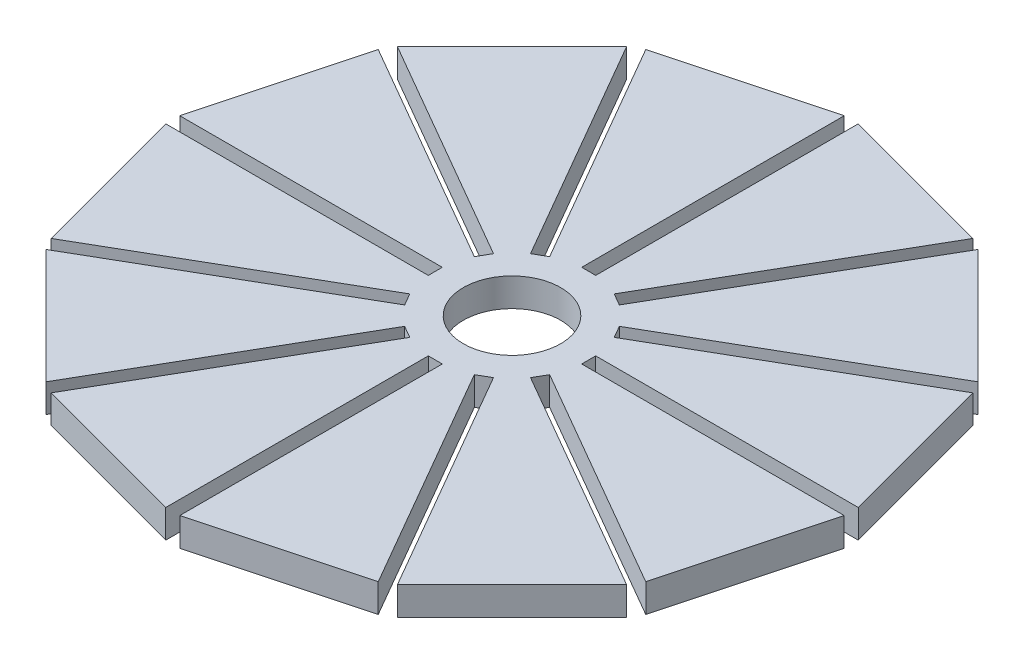
from build123d import *

# Parameters (mm, degrees)
SKETCH1_R           = 10.308435719
BOSS_EXTRUDE1_DEPTH = 6


with BuildPart() as part:
    # Sketch1 → Boss-Extrude1 (new body)
    with BuildSketch(Plane(origin=(0, 0, 0), x_dir=(1, 0, 0), z_dir=(0, 1, 0))):
        Polygon((9.406647228, 13.324720403), (37.205859161, 61.474367881), (61.474367881, 37.205859161), (13.324720403, 9.406647228), (14.808755665, 6.836222753), (62.958403143, 34.635434686), (71.841293847, 1.484035262), (16.242869981, 1.484035262), (16.242869981, -1.484035262), (71.841293847, -1.484035262), (62.958403143, -34.635434686), (14.808755665, -6.836222753), (13.324720403, -9.406647228), (61.474367881, -37.205859161), (37.205859161, -61.474367881), (9.406647228, -13.324720403), (6.836222753, -14.808755665), (34.635434686, -62.958403143), (1.484035262, -71.841293847), (1.484035262, -16.242869981), (-1.484035262, -16.242869981), (-1.484035262, -71.841293847), (-34.635434686, -62.958403143), (-6.836222753, -14.808755665), (-9.406647228, -13.324720403), (-37.205859161, -61.474367881), (-61.474367881, -37.205859161), (-13.324720403, -9.406647228), (-14.808755665, -6.836222753), (-62.958403143, -34.635434686), (-71.841293847, -1.484035262), (-16.242869981, -1.484035262), (-16.242869981, 1.484035262), (-71.841293847, 1.484035262), (-62.958403143, 34.635434686), (-14.808755665, 6.836222753), (-13.324720403, 9.406647228), (-61.474367881, 37.205859161), (-37.205859161, 61.474367881), (-9.406647228, 13.324720403), (-6.836222753, 14.808755665), (-34.635434686, 62.958403143), (-1.484035262, 71.841293847), (-1.484035262, 16.242869981), (1.484035262, 16.242869981), (1.484035262, 71.841293847), (34.635434686, 62.958403143), (6.836222753, 14.808755665), align=None)
        Circle(SKETCH1_R, mode=Mode.SUBTRACT)
    extrude(amount=-BOSS_EXTRUDE1_DEPTH)


solid = part.part
